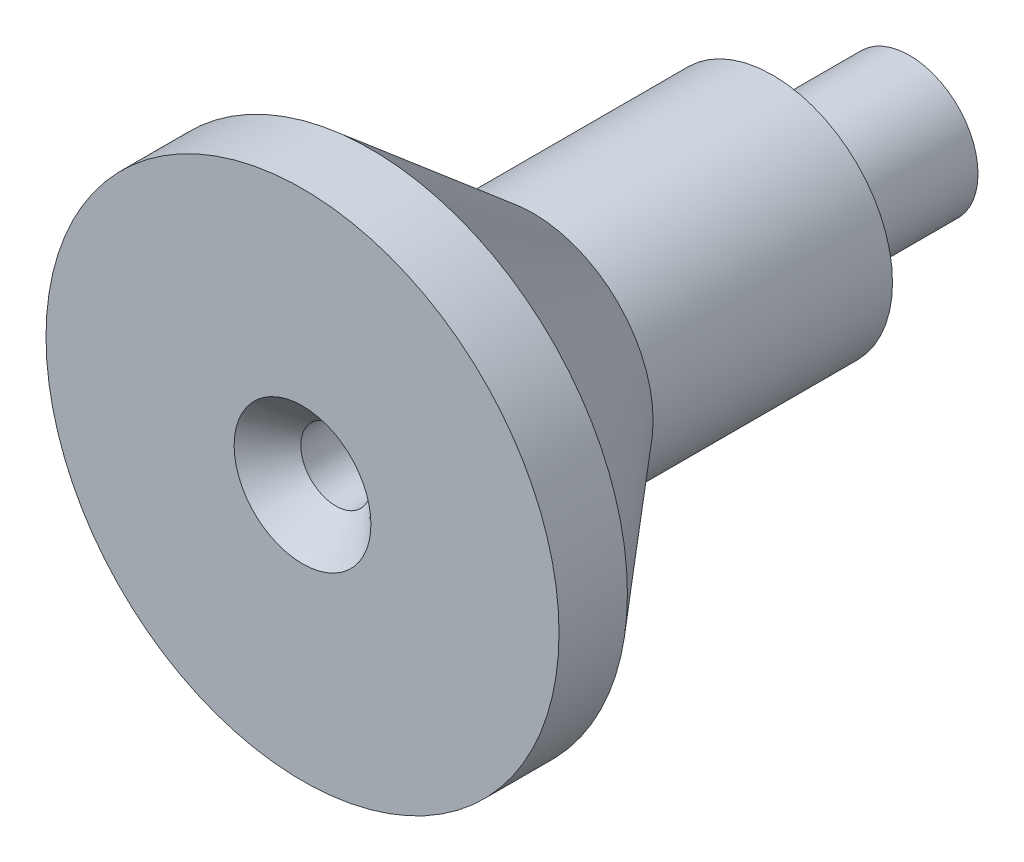
from build123d import *

# Parameters (mm, degrees)
BROCA_DE_ROSQUEAR_PARA_TARRAXA_DE_M2_5X0_D = 2.05
FURO_ROSCADO_DE_M3X0_53_D                  = 2.5
FURO_ROSCADO_DE_M3X0_53_DEPTH              = 10
FURO_ROSCADO_DE_M3X0_53_TIP                = 0.751075774


with BuildPart() as part:
    # Esboço1 → Revolução1 (revolve)
    with BuildSketch(Plane(origin=(0, 0, 0), x_dir=(1, 0, 0), z_dir=(0, 1, 0))):
        Polygon((0, 0), (7.5, 0), (7.5, 2), (3.5, 6.75), (3.5, 13.75), (2, 13.75), (2, 17.75), (0, 17.75), align=None)
    revolve(axis=Axis((0, 0, 0), (0, 0, -1)))

    # Esboço8 → Corte-Revolução3 (revolve, cut)
    with BuildSketch(Plane(origin=(0, 0, 0), x_dir=(1, 0, 0), z_dir=(0, 1, 0))):
        Polygon((0, 0), (2, 0), (0, 2), align=None)
    revolve(axis=Axis((0, 0, -3.199109989), (0, 0, 1)), mode=Mode.SUBTRACT)

    # Broca de rosquear para tarraxa de M2.5x0.451 (through all)
    with Locations(Plane.XY):
        with Locations((0, 0)):
            Hole(BROCA_DE_ROSQUEAR_PARA_TARRAXA_DE_M2_5X0_D / 2)

    # Furo roscado de M3x0.53
    with Locations(Plane(origin=(0, 0, -17.75), x_dir=(-1, 0, 0), z_dir=(0, 0, -1))):
        with Locations((0, 0)):
            Hole(FURO_ROSCADO_DE_M3X0_53_D / 2, depth=FURO_ROSCADO_DE_M3X0_53_DEPTH)
            with Locations((0, 0, -(FURO_ROSCADO_DE_M3X0_53_DEPTH + FURO_ROSCADO_DE_M3X0_53_TIP / 2))):  # 118° drill point
                Cone(0, FURO_ROSCADO_DE_M3X0_53_D / 2, FURO_ROSCADO_DE_M3X0_53_TIP, mode=Mode.SUBTRACT)


solid = part.part
